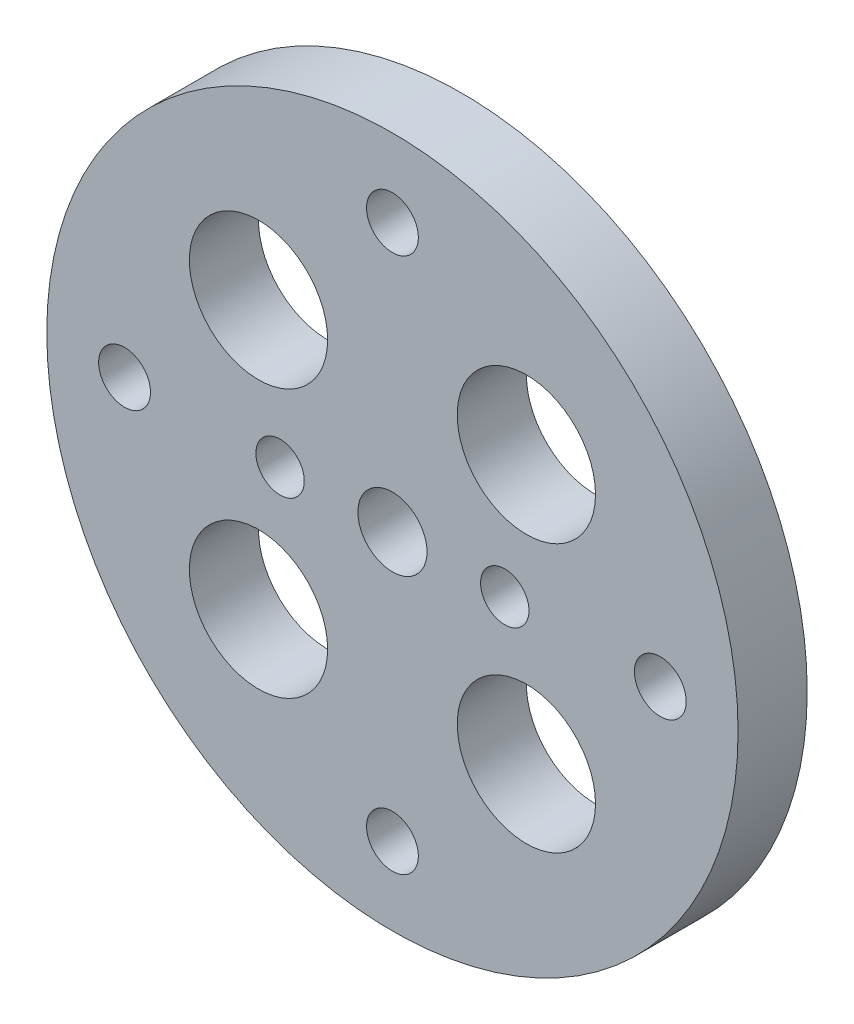
from build123d import *

# Parameters (mm, degrees)
SKETCH_1_R      = 20
SKETCH_1_R_2    = 2
SKETCH_1_R_3    = 1.4
SKETCH_1_R_4    = 1.5
SKETCH_1_R_5    = 4
EXTRUDE_1_DEPTH = 4


with BuildPart() as part:
    # 草图1 → 凸台-拉伸1 (new body)
    with BuildSketch(Plane.XY):
        Circle(SKETCH_1_R)
        Circle(SKETCH_1_R_2, mode=Mode.SUBTRACT)
        with Locations((6.5, 0)):
            Circle(SKETCH_1_R_3, mode=Mode.SUBTRACT)
        with Locations((0, -15.5)):
            Circle(SKETCH_1_R_4, mode=Mode.SUBTRACT)
        with Locations((-15.5, 0)):
            Circle(SKETCH_1_R_4, mode=Mode.SUBTRACT)
        with Locations((0, 15.5)):
            Circle(SKETCH_1_R_4, mode=Mode.SUBTRACT)
        with Locations((15.5, 0)):
            Circle(SKETCH_1_R_4, mode=Mode.SUBTRACT)
        with Locations(Location((-6.5, 0, 0), (0, 0, 180))):
            Circle(SKETCH_1_R_3, mode=Mode.SUBTRACT)
        with Locations((-7.75, 7.75)):
            Circle(SKETCH_1_R_5, mode=Mode.SUBTRACT)
        with Locations((7.75, 7.75)):
            Circle(SKETCH_1_R_5, mode=Mode.SUBTRACT)
        with Locations((7.75, -7.75)):
            Circle(SKETCH_1_R_5, mode=Mode.SUBTRACT)
        with Locations((-7.75, -7.75)):
            Circle(SKETCH_1_R_5, mode=Mode.SUBTRACT)
    extrude(amount=EXTRUDE_1_DEPTH)


solid = part.part
